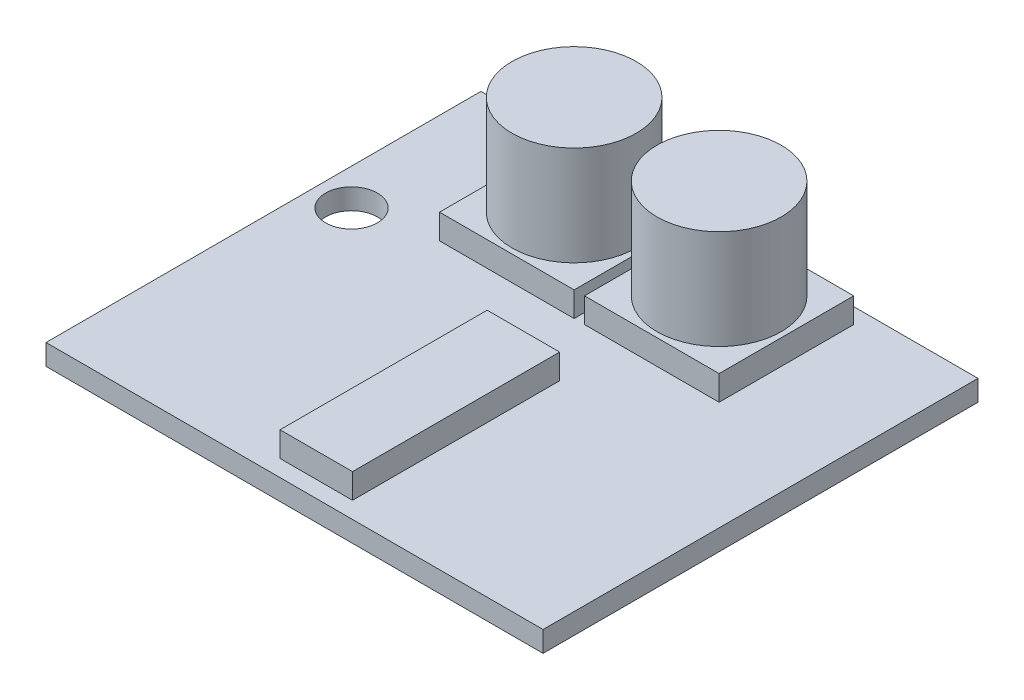
from build123d import *

# Parameters (mm, degrees)
SKETCH1_W           = 24
SKETCH1_H           = 21
SKETCH1_R           = 1.25
BOSS_EXTRUDE1_DEPTH = 1
SKETCH2_R           = 3
BOSS_EXTRUDE2_DEPTH = 6
SKETCH3_W           = 6.5
SKETCH3_H           = 6.5
SKETCH3_W_2         = 3.5
SKETCH3_H_2         = 10
BOSS_EXTRUDE3_DEPTH = 1.2


with BuildPart() as part:
    # Sketch1 → Boss-Extrude1 (new body)
    with BuildSketch(Plane(origin=(0, 0, 0), x_dir=(1, 0, 0), z_dir=(0, 1, 0))):
        Rectangle(SKETCH1_W, SKETCH1_H)
        with Locations(Location((-10.25, 2.5, 0), (0, 0, 270))):
            Circle(SKETCH1_R, mode=Mode.SUBTRACT)
    extrude(amount=BOSS_EXTRUDE1_DEPTH)

    # Sketch2 → Boss-Extrude2 (add)
    with BuildSketch(Plane(origin=(0, 1, 0), x_dir=(1, 0, 0), z_dir=(0, 1, 0))):
        with Locations(Location((3.5, 6.5, 0), (0, 0, 270))):
            Circle(SKETCH2_R)
        with Locations(Location((-3.5, 6.5, 0), (0, 0, 270))):
            Circle(SKETCH2_R)
    extrude(amount=BOSS_EXTRUDE2_DEPTH)

    # Sketch3 → Boss-Extrude3 (add)
    with BuildSketch(Plane(origin=(0, 1, 0), x_dir=(1, 0, 0), z_dir=(0, 1, 0))):
        with Locations((-3.5, 6.5)):
            Rectangle(SKETCH3_W, SKETCH3_H)
        with Locations((3.5, 6.5)):
            Rectangle(SKETCH3_W, SKETCH3_H)
        with Locations((0.25, -4.7)):
            Rectangle(SKETCH3_W_2, SKETCH3_H_2)
    extrude(amount=BOSS_EXTRUDE3_DEPTH)


solid = part.part
